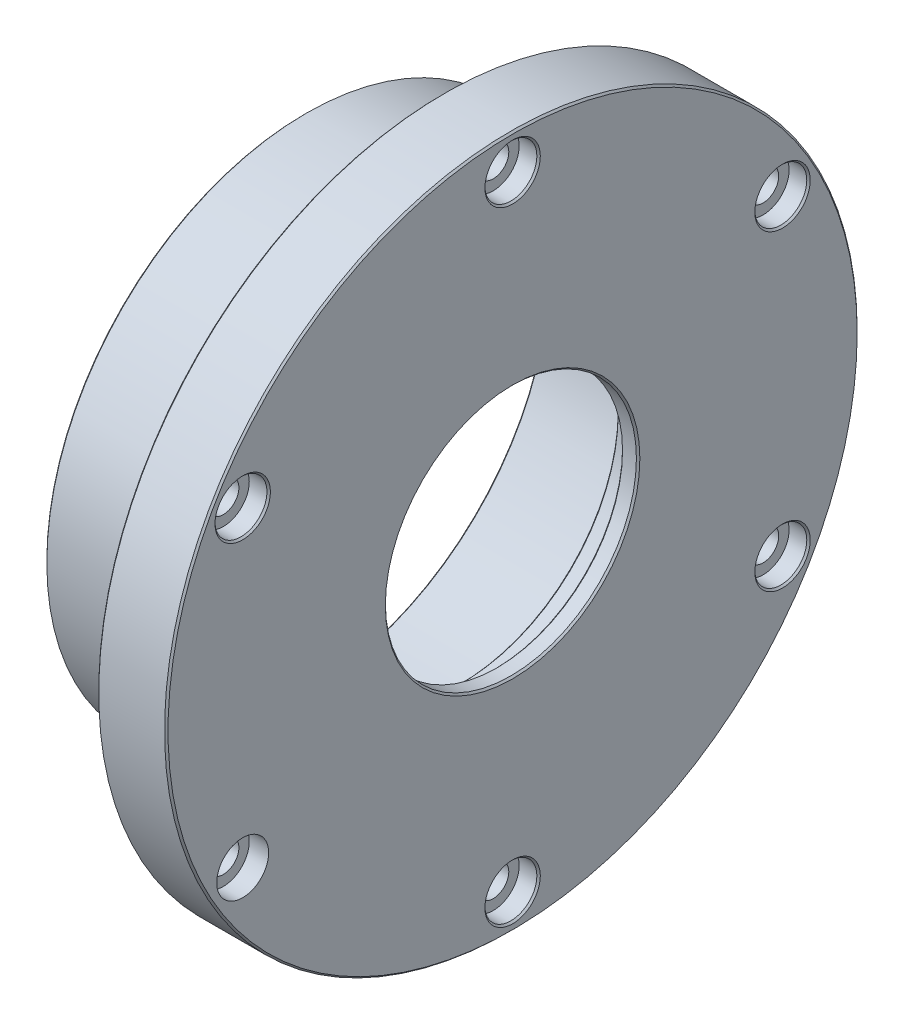
from build123d import *

# Parameters (mm, degrees)
CBORE_FOR_M8_HEX_SOCKET_THIN_HEAD_CAP_SC_D           = 9
CBORE_FOR_M8_HEX_SOCKET_THIN_HEAD_CAP_SC_DEPTH       = 20
CBORE_FOR_M8_HEX_SOCKET_THIN_HEAD_CAP_SC_CBORE_D     = 15
CBORE_FOR_M8_HEX_SOCKET_THIN_HEAD_CAP_SC_CBORE_DEPTH = 5.6
CBORE_FOR_M8_HEX_SOCKET_THIN_HEAD_CAP_SC_TIP         = 2.703872786
CHAMFER1_SIZE                                        = 0.5


with BuildPart() as part:
    # Sketch1 → Revolve1 (revolve)
    with BuildSketch(Plane.XY, mode=Mode.PRIVATE) as revolve1_sk:
        Polygon((22.938748471, 66.816763283), (42.938748471, 66.816763283), (42.938748471, 3.066763283), (37.938748471, 3.066763283), (37.938748471, 11.816763283), (27.938748471, 11.816763283), (27.938748471, 26.816763283), (21.938748471, 26.816763283), (21.938748471, 36.816763283), (-17.061251529, 36.816763283), (-17.061251529, 41.816763283), (22.938748471, 41.816763283), align=None)
    revolve(revolve1_sk.sketch.rotate(Axis((-15.261904536, -33.183236717, 0), (1, 0, 0)), 90), axis=Axis((-15.261904536, -33.183236717, 0), (1, 0, 0)))

    # CBORE for M8 Hex Socket Thin Head Cap Screw1
    with Locations(Plane(origin=(42.938748471, 0, 0), x_dir=(0, 0, -1), z_dir=(1, 0, 0))):
        with Locations((77.942286341, 11.816763283), (0, 56.816763283), (0, -33.183236717), (-77.942286341, 11.816763283), (-77.942286341, -78.183236717), (0, -123.183236717), (77.942286341, -78.183236717)):
            CounterBoreHole(CBORE_FOR_M8_HEX_SOCKET_THIN_HEAD_CAP_SC_D / 2, CBORE_FOR_M8_HEX_SOCKET_THIN_HEAD_CAP_SC_CBORE_D / 2, CBORE_FOR_M8_HEX_SOCKET_THIN_HEAD_CAP_SC_CBORE_DEPTH, depth=CBORE_FOR_M8_HEX_SOCKET_THIN_HEAD_CAP_SC_DEPTH)
            with Locations((0, 0, -(CBORE_FOR_M8_HEX_SOCKET_THIN_HEAD_CAP_SC_DEPTH + CBORE_FOR_M8_HEX_SOCKET_THIN_HEAD_CAP_SC_TIP / 2))):  # 118° drill point
                Cone(0, CBORE_FOR_M8_HEX_SOCKET_THIN_HEAD_CAP_SC_D / 2, CBORE_FOR_M8_HEX_SOCKET_THIN_HEAD_CAP_SC_TIP, mode=Mode.SUBTRACT)

    # Chamfer1
    chamfer1_edges = [part.edges().sort_by_distance(p)[0] for p in [
        (21.938748471, -33.183236717, -60),
        (-17.061251529, -33.183236717, -70),
        (-17.061251529, -33.183236717, -75),
        (22.938748471, -33.183236717, -100),
        (42.938748471, -33.183236717, -100),
        (42.938748471, -33.183236717, -36.25),
        (37.938748471, -33.183236717, -36.25),
        (27.938748471, -33.183236717, -45),
        (42.938748471, 11.816763283, -70.442286341),
        (22.938748471, 11.816763283, -82.442286341),
        (42.938748471, -78.183236717, -70.442286341),
        (22.938748471, -78.183236717, -82.442286341),
        (42.938748471, -123.183236717, 7.5),
        (22.938748471, -123.183236717, -4.5),
        (22.938748471, -78.183236717, 73.442286341),
        (42.938748471, 11.816763283, 85.442286341),
        (22.938748471, 11.816763283, 73.442286341),
        (42.938748471, 56.816763283, 7.5),
        (22.938748471, 56.816763283, -4.5),
    ]]
    chamfer(chamfer1_edges, length=CHAMFER1_SIZE)


solid = part.part
